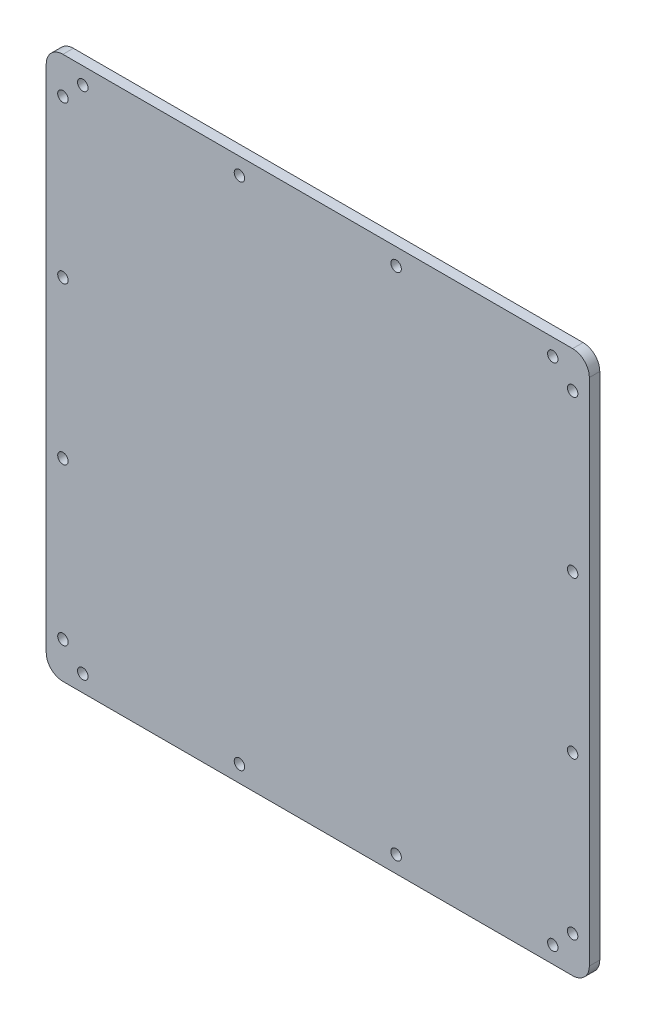
from build123d import *

# Parameters (mm, degrees)
SKETCH_1_R      = 2.5
EXTRUDE_4_DEPTH = 5


with BuildPart() as part:
    # 草图1 → 凸台-拉伸4 (new body)
    with BuildSketch(Plane.XY):
        with BuildLine():
            Line((8, 260), (252, 260))
            ThreePointArc((252, 260), (257.656854249, 257.656854249), (260, 252))
            Line((260, 252), (260, 8))
            ThreePointArc((260, 8), (257.656854249, 2.343145751), (252, 0))
            Line((252, 0), (8, 0))
            ThreePointArc((8, 0), (2.343145751, 2.343145751), (0, 8))
            Line((0, 8), (0, 252))
            ThreePointArc((0, 252), (2.343145751, 257.656854249), (8, 260))
        make_face()
        with Locations((17.5, 8)):
            Circle(SKETCH_1_R, mode=Mode.SUBTRACT)
        with Locations((92.5, 8)):
            Circle(SKETCH_1_R, mode=Mode.SUBTRACT)
        with Locations((167.5, 8)):
            Circle(SKETCH_1_R, mode=Mode.SUBTRACT)
        with Locations((242.5, 8)):
            Circle(SKETCH_1_R, mode=Mode.SUBTRACT)
        with Locations((252, 242.5)):
            Circle(SKETCH_1_R, mode=Mode.SUBTRACT)
        with Locations((252, 167.5)):
            Circle(SKETCH_1_R, mode=Mode.SUBTRACT)
        with Locations((252, 92.5)):
            Circle(SKETCH_1_R, mode=Mode.SUBTRACT)
        with Locations((252, 17.5)):
            Circle(SKETCH_1_R, mode=Mode.SUBTRACT)
        with Locations(Location((242.5, 252, 0), (0, 0, 180))):
            Circle(SKETCH_1_R, mode=Mode.SUBTRACT)
        with Locations(Location((167.5, 252, 0), (0, 0, 180))):
            Circle(SKETCH_1_R, mode=Mode.SUBTRACT)
        with Locations(Location((92.5, 252, 0), (0, 0, 180))):
            Circle(SKETCH_1_R, mode=Mode.SUBTRACT)
        with Locations(Location((17.5, 252, 0), (0, 0, 180))):
            Circle(SKETCH_1_R, mode=Mode.SUBTRACT)
        with Locations(Location((8, 17.5, 0), (0, 0, 180))):
            Circle(SKETCH_1_R, mode=Mode.SUBTRACT)
        with Locations(Location((8, 92.5, 0), (0, 0, 180))):
            Circle(SKETCH_1_R, mode=Mode.SUBTRACT)
        with Locations(Location((8, 167.5, 0), (0, 0, 180))):
            Circle(SKETCH_1_R, mode=Mode.SUBTRACT)
        with Locations(Location((8, 242.5, 0), (0, 0, 180))):
            Circle(SKETCH_1_R, mode=Mode.SUBTRACT)
    extrude(amount=EXTRUDE_4_DEPTH)


solid = part.part
